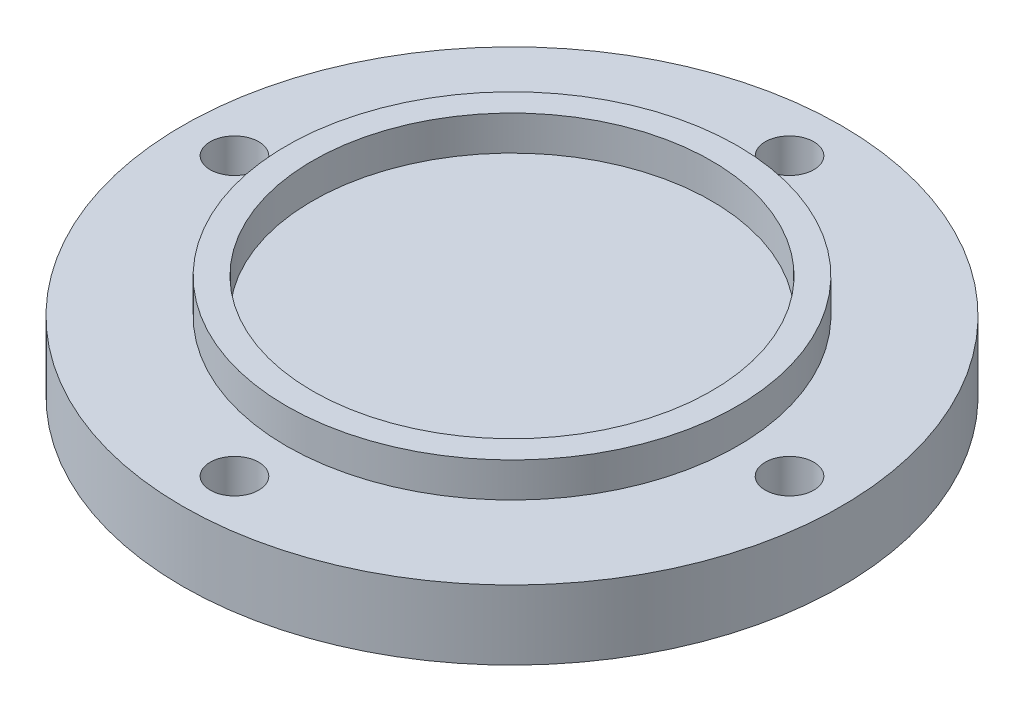
from build123d import *

# Parameters (mm, degrees)
SKETCH1_R           = 95
BOSS_EXTRUDE1_DEPTH = 10
SKETCH2_R           = 65
BOSS_EXTRUDE2_DEPTH = 10
SKETCH3_R           = 57.5
CUT_EXTRUDE1_DEPTH  = 10
SKETCH4_R           = 7
CUT_EXTRUDE2_DEPTH  = 136.830777072


with BuildPart() as part:
    # Sketch1 → Boss-Extrude1 (new, symmetric)
    with BuildSketch(Plane(origin=(0, 0, 0), x_dir=(1, 0, 0), z_dir=(0, 1, 0))):
        with Locations(Location((0, 0, 0), (0, 0, 270))):
            Circle(SKETCH1_R)
    extrude(amount=BOSS_EXTRUDE1_DEPTH, both=True)

    # Sketch2 → Boss-Extrude2 (add)
    with BuildSketch(Plane(origin=(0, 10, 0), x_dir=(1, 0, 0), z_dir=(0, 1, 0))):
        with Locations(Location((0, 0, 0), (0, 0, 270))):
            Circle(SKETCH2_R)
    extrude(amount=BOSS_EXTRUDE2_DEPTH)

    # Sketch3 → Cut-Extrude1 (cut)
    with BuildSketch(Plane(origin=(0, 20, 0), x_dir=(1, 0, 0), z_dir=(0, 1, 0))):
        with Locations(Location((0, 0, 0), (0, 0, 270))):
            Circle(SKETCH3_R)
    extrude(amount=-CUT_EXTRUDE1_DEPTH, mode=Mode.SUBTRACT)

    # Sketch4 → Cut-Extrude2 (cut, through all)
    with BuildSketch(Plane(origin=(0, 10, 0), x_dir=(1, 0, 0), z_dir=(0, 1, 0))):
        with Locations(Location((0, 80, 0), (0, 0, 270))):
            Circle(SKETCH4_R)
        with Locations(Location((80, 0, 0), (0, 0, 270))):
            Circle(SKETCH4_R)
        with Locations(Location((0, -80, 0), (0, 0, 270))):
            Circle(SKETCH4_R)
        with Locations(Location((-80, 0, 0), (0, 0, 270))):
            Circle(SKETCH4_R)
    extrude(amount=-CUT_EXTRUDE2_DEPTH, mode=Mode.SUBTRACT)


solid = part.part
